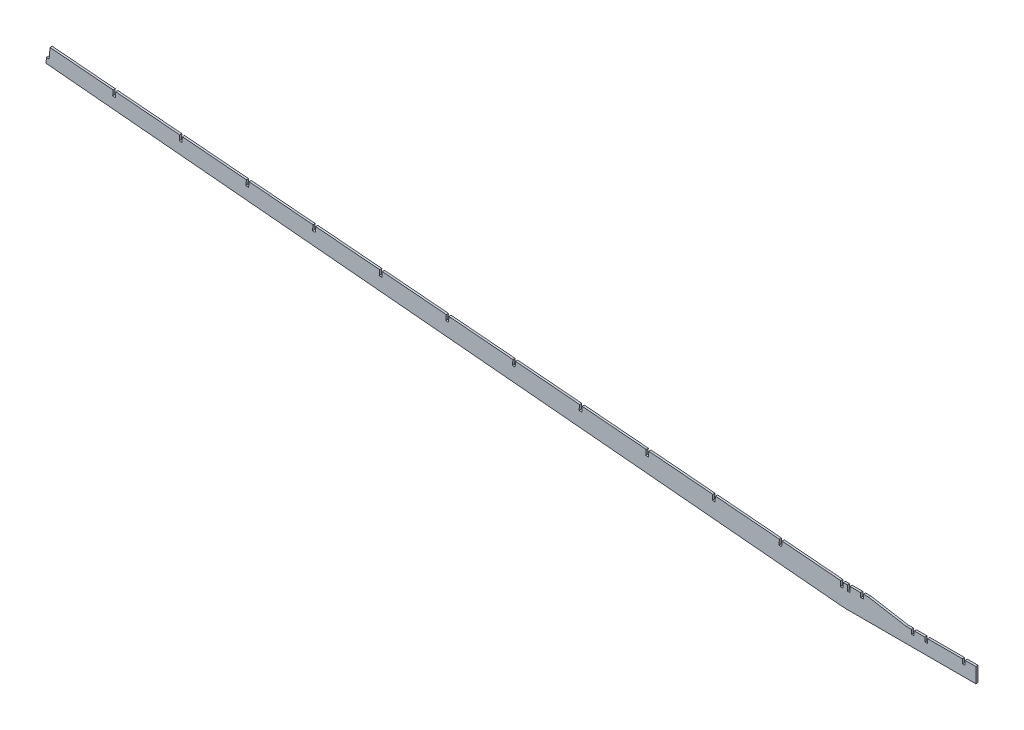
from build123d import *

# Parameters (mm, degrees)
BOSS_EXTRUDE1_DEPTH     = 2.54
CUT_EXTRUDE1_DEPTH      = 955.775766948
CUT_EXTRUDE1_DEPTH_BACK = 955.775766948


with BuildPart() as part:
    # Sketch1 → Boss-Extrude1 (new body)
    with BuildSketch(Plane.XY):
        Polygon((-945.957227657, 86.137779906), (-945.969713578, 86.1172966), (-949.121092485, 86.403457059), (-949.65244679, 80.075727402), (-9.887238192, -5.25964904), (-6.723373364, -5.525326193), (0, -5.833733414), (152.4, -5.833733414), (152.4, 11.946266586), (139.7, 11.946266586), (139.7, 6.866266586), (136.525, 6.866266586), (136.525, 11.946266586), (95.25, 11.946266586), (95.25, 6.866266586), (92.075, 6.866266586), (92.075, 11.946266586), (79.375, 11.946266586), (79.375, 6.866266586), (76.2, 6.866266586), (76.2, 11.946266586), (69.85, 11.946266586), (25.4, 19.566266586), (19.05, 19.566266586), (19.05, 14.486266586), (15.875, 14.486266586), (15.875, 19.566266586), (3.175, 19.566266586), (3.175, 13.216266586), (0, 13.216266586), (0, 19.566266586), (-1.98607431, 19.566266586), (-4.597956143, 19.785592432), (-5.129310448, 13.457862776), (-8.293175277, 13.723539928), (-7.761820971, 20.051269584), (-944.89858306, 98.744842179), align=None)
    extrude(amount=BOSS_EXTRUDE1_DEPTH)

    # Sketch2 → Cut-Extrude1 (cut, two sides: drawn at the far end of the back side and taken through both)
    with BuildSketch(Plane.XY.offset(2.54).offset(-CUT_EXTRUDE1_DEPTH_BACK)):
        Polygon((-77.240292597, 25.885539855), (-80.404157425, 26.151217008), (-80.935453586, 19.824179771), (-77.77159129, 19.55847246), align=None)
        Polygon((-156.741594191, 26.190526923), (-156.210358707, 32.516841584), (-159.374223535, 32.782518736), (-159.905456487, 26.456234233), align=None)
        Polygon((-235.711597092, 32.822581386), (-235.180424816, 39.148143312), (-238.344289645, 39.413820465), (-238.875459388, 33.088288696), align=None)
        Polygon((-314.681599993, 39.454635849), (-314.150490926, 45.77944504), (-317.314355754, 46.045122193), (-317.845462289, 39.720343159), align=None)
        Polygon((-393.651602894, 46.086690311), (-393.120557036, 52.410746769), (-396.284421864, 52.676423921), (-396.81546519, 46.352397622), align=None)
        Polygon((-472.621605795, 52.718744774), (-472.090623146, 59.042048497), (-475.254487974, 59.30772565), (-475.785468091, 52.984452084), align=None)
        Polygon((-551.591608696, 59.350799237), (-551.060689256, 65.673350226), (-554.224554084, 65.939027378), (-554.755470992, 59.616506547), align=None)
        Polygon((-630.561611597, 65.9828537), (-630.030755365, 72.304651954), (-633.194620194, 72.570329107), (-633.725473893, 66.24856101), align=None)
        Polygon((-709.531614498, 72.614908162), (-709.000821475, 78.935953682), (-712.164686303, 79.201630835), (-712.695476794, 72.880615473), align=None)
        Polygon((-788.501617399, 79.246962625), (-787.970887585, 85.567255411), (-791.134752413, 85.832932563), (-791.665479694, 79.512669935), align=None)
        Polygon((-867.4716203, 85.879017088), (-866.940953695, 92.198557139), (-870.104818523, 92.464234292), (-870.635482595, 86.144724398), align=None)
    extrude(amount=CUT_EXTRUDE1_DEPTH + CUT_EXTRUDE1_DEPTH_BACK, mode=Mode.SUBTRACT)


solid = part.part
